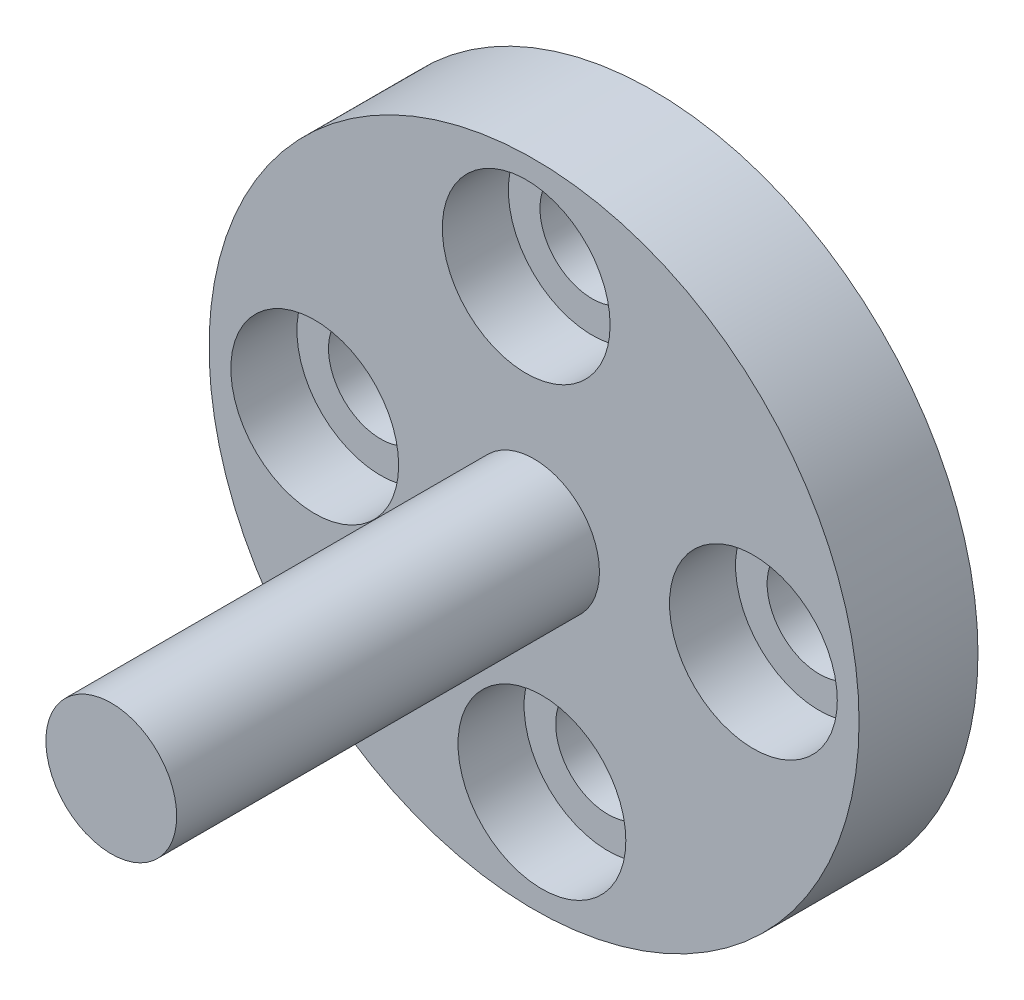
from build123d import *

# Parameters (mm, degrees)
ESQUISSE1_R        = 12.3
ESQUISSE1_R_2      = 1.97989757
ESQUISSE1_R_3      = 3
BOSS_EXTRU_1_DEPTH = 2
ESQUISSE2_R        = 12.3
ESQUISSE2_R_2      = 3.175426481
ESQUISSE2_R_3      = 3
BOSS_EXTRU_2_DEPTH = 2.5
ESQUISSE3_R        = 2.475
BOSS_EXTRU_3_DEPTH = 16


with BuildPart() as part:
    # Esquisse1 → Boss.-Extru.1 (new body)
    with BuildSketch(Plane.XY):
        Circle(ESQUISSE1_R)
        with Locations((-8.3, -0.297454923)):
            Circle(ESQUISSE1_R_2, mode=Mode.SUBTRACT)
        with Locations((-0.297454923, 8.3)):
            Circle(ESQUISSE1_R_2, mode=Mode.SUBTRACT)
        with Locations((8.3, 0.297454923)):
            Circle(ESQUISSE1_R_2, mode=Mode.SUBTRACT)
        with Locations((0.297454923, -8.3)):
            Circle(ESQUISSE1_R_2, mode=Mode.SUBTRACT)
        Circle(ESQUISSE1_R_3, mode=Mode.SUBTRACT)
    extrude(amount=BOSS_EXTRU_1_DEPTH)

    # Esquisse2 → Boss.-Extru.2 (add)
    # profile 1 of 2: a face of its own
    with BuildSketch(Plane.XY.offset(2)):
        Circle(ESQUISSE2_R)
        with Locations((0.297454923, -8.3)):
            Circle(ESQUISSE2_R_2, mode=Mode.SUBTRACT)
        with Locations((8.3, 0.297454923)):
            Circle(ESQUISSE2_R_2, mode=Mode.SUBTRACT)
        with Locations((-0.297454923, 8.3)):
            Circle(ESQUISSE2_R_2, mode=Mode.SUBTRACT)
        with Locations((-8.3, -0.297454923)):
            Circle(ESQUISSE2_R_2, mode=Mode.SUBTRACT)
        Circle(ESQUISSE2_R_3, mode=Mode.SUBTRACT)
    # profile 2 of 2: a face of its own
    with BuildSketch(Plane.XY.offset(2)):
        Circle(ESQUISSE2_R_3)
    extrude(amount=BOSS_EXTRU_2_DEPTH)

    # Esquisse3 → Boss.-Extru.3 (add)
    with BuildSketch(Plane.XY.offset(4.5)):
        Circle(ESQUISSE3_R)
    extrude(amount=BOSS_EXTRU_3_DEPTH)


solid = part.part
